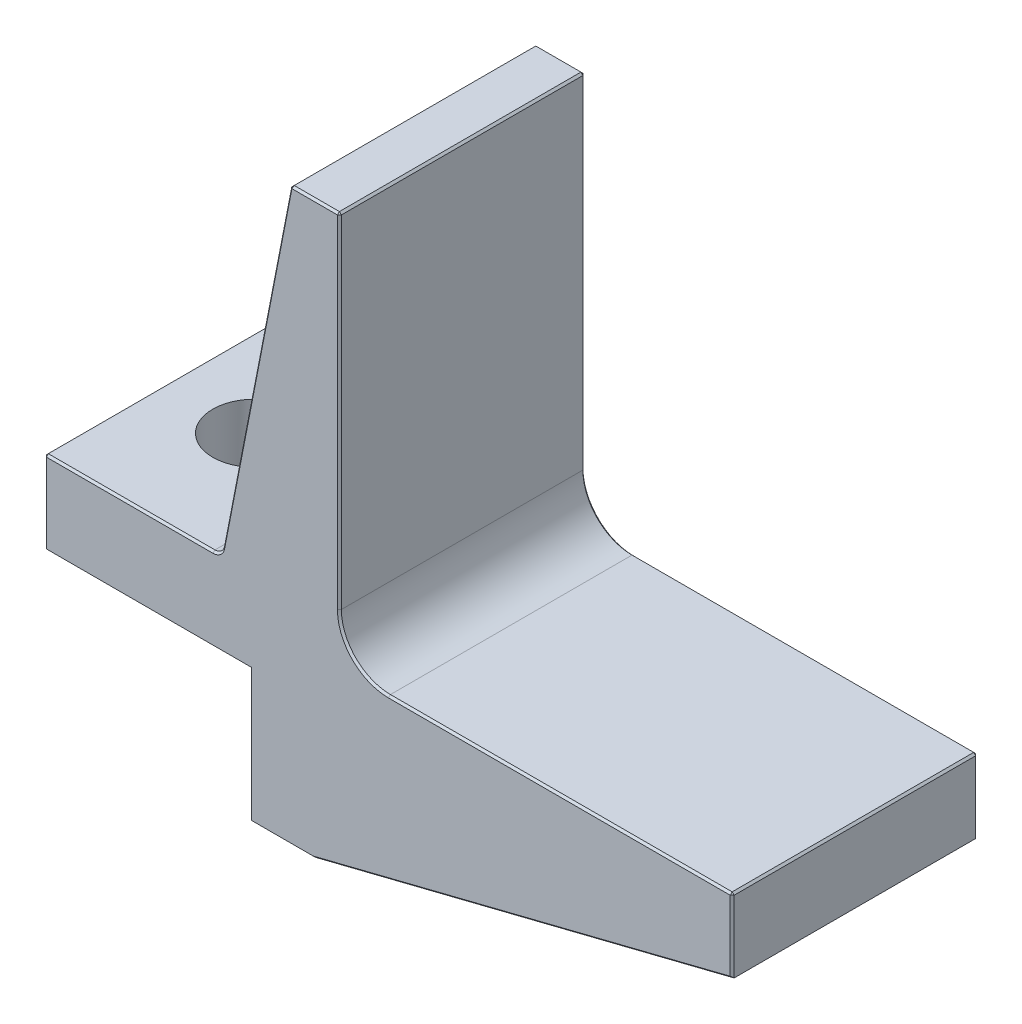
from build123d import *
from OCP.BRepFilletAPI import BRepFilletAPI_MakeChamfer

# Parameters (mm, degrees)
BOSS_EXTRUDE1_DEPTH          = 31.75
F_3_8_0_375_DIAMETER_HOLE1_D = 10.795
FILLET1_R                    = 1.27
FILLET2_R                    = 6.35
CHAMFER1_SIZE                = 0.254
CHAMFER1_SIZE2               = 0.321383695


with BuildPart() as part:
    # Sketch1 → Boss-Extrude1 (new body)
    with BuildSketch(Plane.XY):
        Polygon((0, 0), (50.8, 0), (50.8, -9.525), (-3.3628076, -23.086314), (-11.6178076, -23.086314), (-11.6178076, -5.941314), (-38.1608076, -5.941314), (-38.1608076, 4.853686), (-15.3008076, 4.853686), (-6.35, 50.8), (0, 50.8), align=None)
    extrude(amount=BOSS_EXTRUDE1_DEPTH)

    # 3/8 (0.375) Diameter Hole1 (through all)
    with Locations(Plane(origin=(0, 4.853686, 0), x_dir=(1, 0, 0), z_dir=(0, 1, 0))):
        with Locations((-26.8578076, -15.875)):
            Hole(F_3_8_0_375_DIAMETER_HOLE1_D / 2)

    # Fillet1
    fillet1_edges = [part.edges().sort_by_distance(p)[0] for p in [
        (-15.3008076, 4.853686, 15.875),
    ]]
    fillet(fillet1_edges, radius=FILLET1_R)

    # Fillet2
    fillet2_edges = [part.edges().sort_by_distance(p)[0] for p in [
        (0, 0, 15.875),
    ]]
    fillet(fillet2_edges, radius=FILLET2_R)

    # Chamfer1: one chamfer whose edges measure the first distance from different faces: ONE call of the kernel's chamfer builder (chamfer() names one face for all edges)
    chamfer1_edges_1 = [part.edges().sort_by_distance(p)[0] for p in [
        (28.575, 0, 0),
        (50.8, -4.7625, 0),
        (23.7185962, -16.305657, 0),
        (-7.4903076, -23.086314, 0),
        (-11.6178076, -14.513814, 0),
        (-10.725353572, 28.340421149, 31.75),
        (-24.8893076, -5.941314, 0),
        (-38.1608076, -0.543814, 0),
        (-10.725353572, 28.340421149, 0),
        (-3.175, 50.8, 0),
        (50.8, 0, 15.875),
        (-38.1608076, -5.941314, 15.875),
        (-38.1608076, 4.853686, 15.875),
        (0, 50.8, 15.875),
        (-38.1608076, -0.543814, 31.75),
        (-24.8893076, -5.941314, 31.75),
        (-11.6178076, -14.513814, 31.75),
        (-7.4903076, -23.086314, 31.75),
        (23.7185962, -16.305657, 31.75),
        (-27.254040401, 4.853686, 0),
        (-27.254040401, 4.853686, 31.75),
        (50.8, -4.7625, 31.75),
        (-15.539656801, 5.143555524, 0),
        (-15.539656801, 5.143555524, 31.75),
        (28.575, 0, 31.75),
        (0, 28.575, 0),
        (0, 28.575, 31.75),
        (1.859871939, 1.859871939, 0),
        (1.859871939, 1.859871939, 31.75),
        (-3.175, 50.8, 31.75),
    ]]
    chamfer1_edges_2 = [part.edges().sort_by_distance(p)[0] for p in [
        (-6.35, 50.8, 15.875),
    ]]
    chamfer1_side_2 = [part.faces().sort_by_distance(p)[0] for p in [
        (-3.175, 50.8, 15.875),
    ]]
    chamfer1 = BRepFilletAPI_MakeChamfer(part.part.solid().wrapped)
    for e in chamfer1_edges_1:
        chamfer1.Add(CHAMFER1_SIZE, e.wrapped)
    for e in chamfer1_edges_2:
        chamfer1.Add(CHAMFER1_SIZE, CHAMFER1_SIZE2, e.wrapped, chamfer1_side_2[0].wrapped)  # the first distance lies on this face
    add(Compound.cast(chamfer1.Shape()), mode=Mode.REPLACE)


solid = part.part
